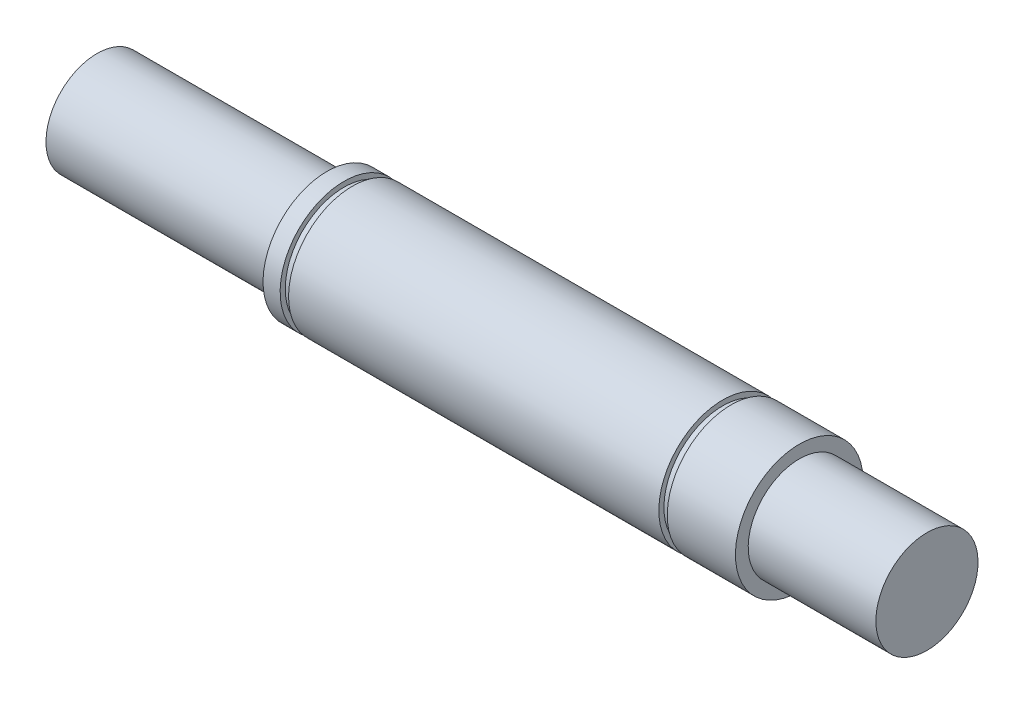
from build123d import *


with BuildPart() as part:
    # Sketch1 → Revolve1 (revolve)
    with BuildSketch(Plane.XY, mode=Mode.PRIVATE) as revolve1_sk:
        Polygon((-145.473243459, -1.204543566), (-145.473243459, 2.795456434), (-155.473243459, 2.795456434), (-155.473243459, 3.795456434), (-160.813243459, 3.795456434), (-160.813243459, 3.395456434), (-161.473243459, 3.395456434), (-161.473243459, 3.795456434), (-190.473243459, 3.795456434), (-190.473243459, 3.395456434), (-191.133243459, 3.395456434), (-191.133243459, 3.795456434), (-192.473243459, 3.795456434), (-192.473243459, 2.795456434), (-210.473243459, 2.795456434), (-210.473243459, -1.204543566), align=None)
    revolve(revolve1_sk.sketch.rotate(Axis((-210.473243459, -1.204543566, 0), (1, 0, 0)), 180), axis=Axis((-210.473243459, -1.204543566, 0), (1, 0, 0)))


solid = part.part
